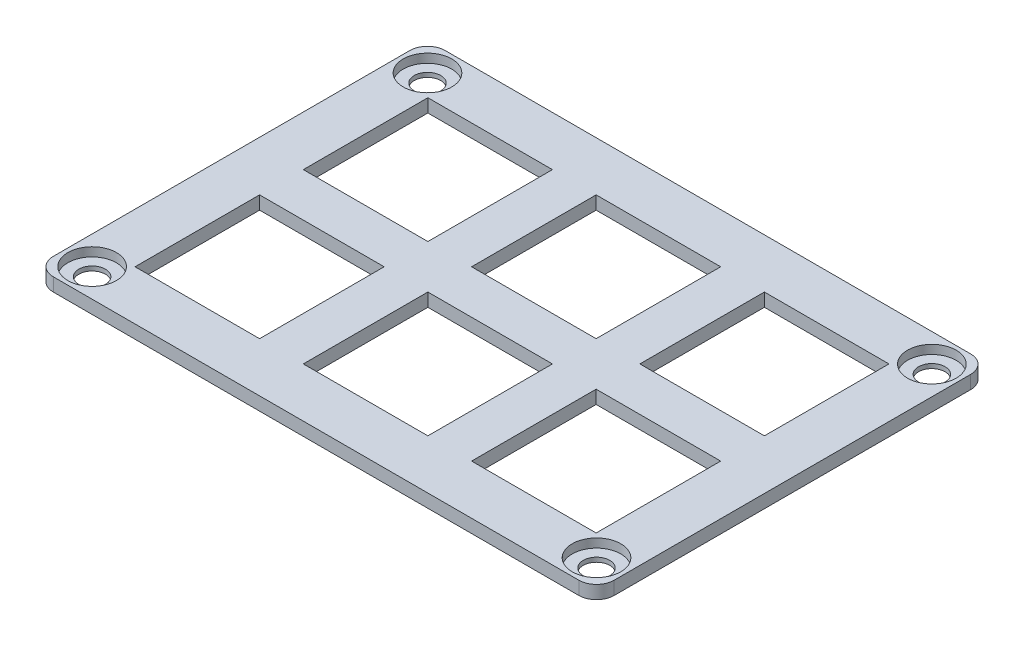
from build123d import *

# Parameters (mm, degrees)
SKETCH1_W           = 63.5
SKETCH1_H           = 44.36533333
BOSS_EXTRUDE1_DEPTH = 1.5
SKETCH2_R           = 1.5
SKETCH2_W           = 14.1
SKETCH2_H           = 14.1
CUT_EXTRUDE1_DEPTH  = 78.477627748
SKETCH4_R           = 2.75
CUT_EXTRUDE2_DEPTH  = 1
FILLET1_R           = 2


with BuildPart() as part:
    # Sketch1 → Boss-Extrude1 (new body)
    with BuildSketch(Plane(origin=(0, 0, 0), x_dir=(1, 0, 0), z_dir=(0, 1, 0))):
        with Locations((31.75, 22.182666665)):
            Rectangle(SKETCH1_W, SKETCH1_H)
    extrude(amount=BOSS_EXTRUDE1_DEPTH)

    # Sketch2 → Cut-Extrude1 (cut, through all)
    with BuildSketch(Plane(origin=(0, 1.5, 0), x_dir=(1, 0, 0), z_dir=(0, 1, 0))):
        with Locations(Location((3.2, 41.16533333, 0), (0, 0, 270))):
            Circle(SKETCH2_R)
        with Locations(Location((60.3, 41.16533333, 0), (0, 0, 270))):
            Circle(SKETCH2_R)
        with Locations(Location((60.3, 3.2, 0), (0, 0, 270))):
            Circle(SKETCH2_R)
        with Locations(Location((3.2, 3.2, 0), (0, 0, 270))):
            Circle(SKETCH2_R)
        with Locations((12.7, 31.70766667)):
            Rectangle(SKETCH2_W, SKETCH2_H)
        with Locations((31.75, 31.70766667)):
            Rectangle(SKETCH2_W, SKETCH2_H)
        with Locations((50.8, 31.70766667)):
            Rectangle(SKETCH2_W, SKETCH2_H)
        with Locations((12.7, 12.65766667)):
            Rectangle(SKETCH2_W, SKETCH2_H)
        with Locations((31.75, 12.65766667)):
            Rectangle(SKETCH2_W, SKETCH2_H)
        with Locations((50.8, 12.65766667)):
            Rectangle(SKETCH2_W, SKETCH2_H)
    extrude(amount=-CUT_EXTRUDE1_DEPTH, mode=Mode.SUBTRACT)

    # Sketch4 → Cut-Extrude2 (cut)
    with BuildSketch(Plane(origin=(0, 1.5, 0), x_dir=(1, 0, 0), z_dir=(0, 1, 0))):
        with Locations(Location((3.2, 41.16533333, 0), (0, 0, 270))):
            Circle(SKETCH4_R)
        with Locations(Location((60.3, 41.16533333, 0), (0, 0, 270))):
            Circle(SKETCH4_R)
        with Locations(Location((60.3, 3.2, 0), (0, 0, 270))):
            Circle(SKETCH4_R)
        with Locations(Location((3.2, 3.2, 0), (0, 0, 270))):
            Circle(SKETCH4_R)
    extrude(amount=-CUT_EXTRUDE2_DEPTH, mode=Mode.SUBTRACT)

    # Fillet1
    fillet1_edges = [part.edges().sort_by_distance(p)[0] for p in [
        (0, 0.75, -44.36533333),
        (63.5, 0.75, -44.36533333),
        (63.5, 0.75, 0),
        (0, 0.75, 0),
    ]]
    fillet(fillet1_edges, radius=FILLET1_R)


solid = part.part
